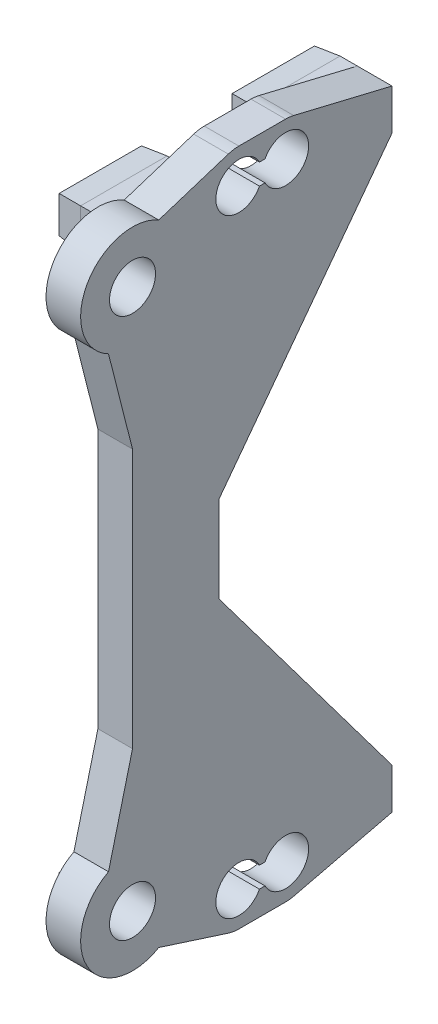
from build123d import *

# Parameters (mm, degrees)
SKETCH3_R                = 3.81
DOWELSUPPORT_DEPTH       = 1.27
SKETCH5_W                = 6.35
SKETCH5_H                = 19.05
SLIDERDOWELSUPPORT_DEPTH = 1.27
STRINGDOWELSUPPORT_DEPTH = 1.27
SKETCH9_W                = 6.35
SKETCH9_H                = 3
TABSUPPORT_DEPTH         = 1.27
INTERSUPPORT_DEPTH       = 1.27
DOWELHOLES_DEPTH         = 30.550637709
DOWELHOLES_DEPTH_BACK    = 30.550637709
SKETCH11_R               = 1.690500048
SKETCH14_W               = 6.35
SKETCH14_H               = 3
TABBASE_DEPTH            = 1.27
SKETCH15_W               = 6.35
SKETCH15_H               = 3
TABDRAFT_DEPTH           = 1.73
TABDRAFT_DRAFT           = 5
TABDRAFT_PROFILE_2_DEPTH = 1.73
TABDRAFT_PROFILE_2_DRAFT = 5


with BuildPart() as part:
    # Sketch3 → DowelSupport (new, symmetric)
    with BuildSketch(Plane(origin=(0, 0, 0), x_dir=(0, 0, -1), z_dir=(1, 0, 0))):
        with Locations((-3.175, 19.84375)):
            Circle(SKETCH3_R)
    extrude(amount=DOWELSUPPORT_DEPTH, both=True)



with BuildPart() as body_2:
    # Sketch5 → SliderDowelSupport (new, symmetric)
    with BuildSketch(Plane(origin=(0, 0, 0), x_dir=(0, 0, -1), z_dir=(1, 0, 0))):
        Rectangle(SKETCH5_W, SKETCH5_H)
    extrude(amount=SLIDERDOWELSUPPORT_DEPTH, both=True)


with BuildPart() as body_3:
    # Sketch8 → StringDowelSupport (new, symmetric)
    with BuildSketch(Plane(origin=(0, 0, 0), x_dir=(0, 0, -1), z_dir=(1, 0, 0))):
        with BuildLine():
            Line((4.6355, 24.892), (8.0645, 24.892))
            ThreePointArc((8.0645, 24.892), (10.6045, 22.352), (8.0645, 19.812))
            Line((8.0645, 19.812), (4.6355, 19.812))
            ThreePointArc((4.6355, 19.812), (2.0955, 22.352), (4.6355, 24.892))
        make_face()
    extrude(amount=STRINGDOWELSUPPORT_DEPTH, both=True)


with BuildPart() as part_1:
    add(part.part)

    add(body_3.part)  # TabSupport merges body 3
    # Sketch9 → TabSupport (add, symmetric)
    with BuildSketch(Plane(origin=(0, 0, 0), x_dir=(0, 0, -1), z_dir=(1, 0, 0))):
        with Locations((0, 21.59)):
            Rectangle(SKETCH9_W, SKETCH9_H)
        with Locations((12.7, 21.59)):
            Rectangle(SKETCH9_W, SKETCH9_H)
    extrude(amount=TABSUPPORT_DEPTH, both=True)


    add(body_2.part)  # InterSupport merges body 2
    # Sketch10 → InterSupport (add, symmetric)
    with BuildSketch(Plane(origin=(0, 0, 0), x_dir=(0, 0, -1), z_dir=(1, 0, 0))):
        Polygon((-3.175, 9.525), (-5.636846154, 19.218519231), (-3.951626852, 22.262107032), (3.858873148, 24.770357032), (8.657140431, 24.821894192), (15.875, 23.09), (15.875, 20.09), (3.175, 3.175), (3.175, 9.525), align=None)
    extrude(amount=INTERSUPPORT_DEPTH, both=True)

    # Sketch11 → DowelHoles (cut, two sides: drawn at the far end of the back side and taken through both)
    with BuildSketch(Plane(origin=(0, 0, 0), x_dir=(0, 0, -1), z_dir=(1, 0, 0)).offset(-DOWELHOLES_DEPTH_BACK)):
        with Locations((-3.175, 19.84375)):
            Circle(SKETCH11_R)
        with BuildLine():
            Line((6.144521674, 21.59), (6.555478326, 21.59))
            ThreePointArc((6.555478326, 21.59), (9.755000048, 22.352), (6.555478326, 23.114))
            Line((6.555478326, 23.114), (6.144521674, 23.114))
            ThreePointArc((6.144521674, 23.114), (2.944999952, 22.352), (6.144521674, 21.59))
        make_face()
    extrude(amount=DOWELHOLES_DEPTH + DOWELHOLES_DEPTH_BACK, mode=Mode.SUBTRACT)

    # Sketch14 → TabBase (add)
    with BuildSketch(Plane.ZY.offset(1.27)):
        with Locations((-12.7, 21.59)):
            Rectangle(SKETCH14_W, SKETCH14_H)
        with Locations((0, 21.59)):
            Rectangle(SKETCH14_W, SKETCH14_H)
    extrude(amount=TABBASE_DEPTH)


with BuildPart() as tabdraft_tool:
    # Sketch15 → TabDraft (with draft: the straight prism first)
    with BuildSketch(Plane.ZY.offset(2.54)):
        with Locations((0, 21.59)):
            Rectangle(SKETCH15_W, SKETCH15_H)
    extrude(amount=TABDRAFT_DEPTH)
    # TabDraft: the draft: its side faces are tilted about the plane it starts from
    tabdraft_sides = [tabdraft_tool.faces().sort_by_distance(p)[0] for p in [
        (-3.405, 21.59, -3.175),
        (-3.405, 20.09, 0),
        (-3.405, 21.59, 3.175),
        (-3.405, 23.09, 0),
    ]]
    draft(tabdraft_sides, Plane.ZY.offset(2.54), TABDRAFT_DRAFT)


with BuildPart() as part_2:
    add(part_1.part)

    # TabDraft: add tabdraft_tool
    add(tabdraft_tool.part)


with BuildPart() as tabdraft_profile_2_tool:
    # Sketch15 → TabDraft profile 2 (with draft: the straight prism first)
    with BuildSketch(Plane.ZY.offset(2.54)):
        with Locations((-12.7, 21.59)):
            Rectangle(SKETCH15_W, SKETCH15_H)
    extrude(amount=TABDRAFT_PROFILE_2_DEPTH)
    # TabDraft profile 2: the draft: its side faces are tilted about the plane it starts from
    tabdraft_profile_2_sides = [tabdraft_profile_2_tool.faces().sort_by_distance(p)[0] for p in [
        (-3.405, 21.59, -15.875),
        (-3.405, 20.09, -12.7),
        (-3.405, 21.59, -9.525),
        (-3.405, 23.09, -12.7),
    ]]
    draft(tabdraft_profile_2_sides, Plane.ZY.offset(2.54), TABDRAFT_PROFILE_2_DRAFT)


with BuildPart() as part_3:
    add(part_2.part)

    # TabDraft profile 2: add tabdraft_profile_2_tool
    add(tabdraft_profile_2_tool.part)

    # Mirror1: part across plane


with BuildPart() as part_4:
    add(part_3.part)
    add(part_3.part.mirror(Plane.ZX))


solid = part_4.part
